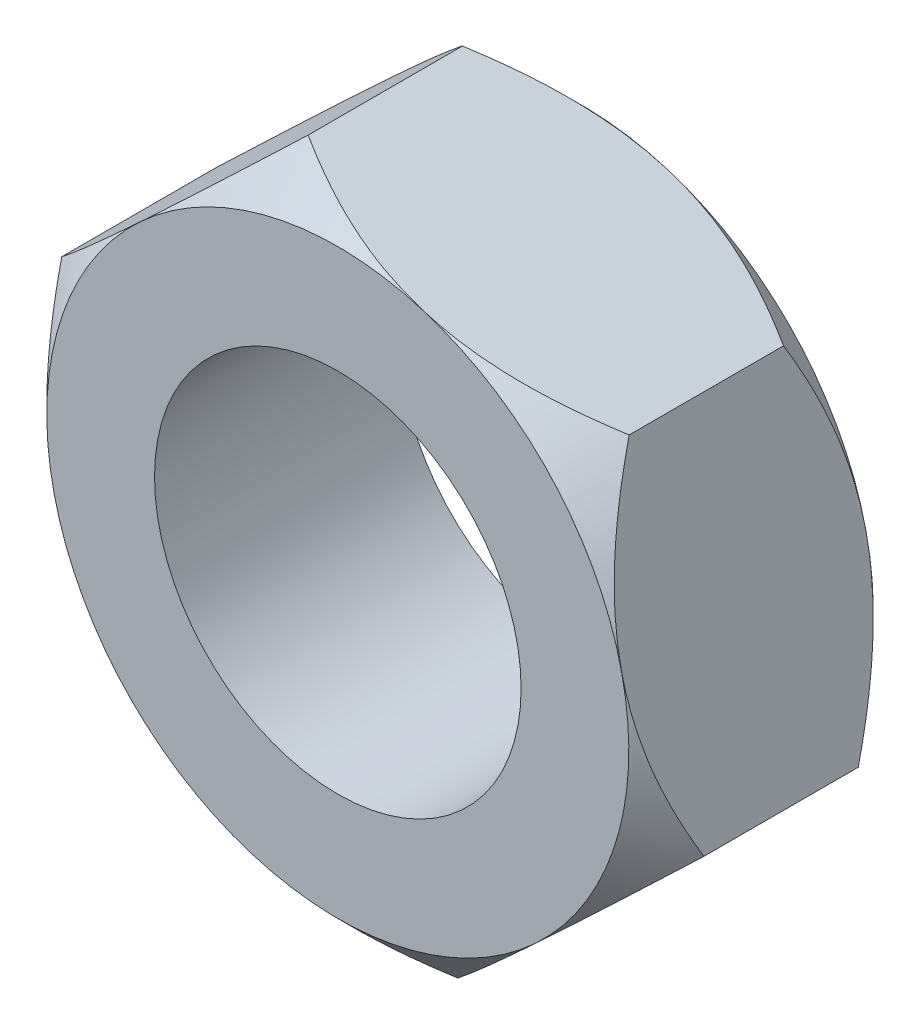
from build123d import *

# Parameters (mm, degrees)
BOSS_EXTRUDE1_DEPTH      = 1
BOSS_EXTRUDE1_DEPTH_BACK = 1
CUT_EXTRUDE1_REACH       = 6.254
SKETCH2_R                = 1.5
SKETCH19_OUTSIDE_W       = 10.31
SKETCH19_OUTSIDE_H       = 10.416
SKETCH19_OUTSIDE_R       = 2.38156986
CUT_EXTRUDE7_DEPTH       = 0.75
CUT_EXTRUDE7_DRAFT       = -45
MIRROR1_COPY_1_SKETCH_W  = 10.31
MIRROR1_COPY_1_SKETCH_H  = 10.416
MIRROR1_COPY_1_SKETCH_R  = 2.38156986
MIRROR1_COPY_1_DEPTH     = 0.75
MIRROR1_COPY_1_DRAFT     = -45


with BuildPart() as part:
    # Sketch1 → Boss-Extrude1 (new, two sides: drawn at the far end of the back side and taken through both)
    with BuildSketch(Plane.XY.offset(-BOSS_EXTRUDE1_DEPTH_BACK)):
        Polygon((2.627673365, -0.811068855), (2.016242915, 1.87009746), (-0.61143045, 2.681166314), (-2.627673365, 0.811068855), (-2.016242915, -1.87009746), (0.61143045, -2.681166314), align=None)
    extrude(amount=BOSS_EXTRUDE1_DEPTH + BOSS_EXTRUDE1_DEPTH_BACK)

    # Sketch2 → Cut-Extrude1 (cut, up to next)
    with BuildSketch(Plane.XY.offset(1), mode=Mode.PRIVATE) as cut_extrude1_sk1:
        Circle(SKETCH2_R)
    cut_extrude1_tool1 = extrude(cut_extrude1_sk1.sketch, amount=-CUT_EXTRUDE1_REACH, mode=Mode.PRIVATE) & part.part
    add(cut_extrude1_tool1.solids().sort_by_distance((0, 0, 1))[0], mode=Mode.SUBTRACT)


with BuildPart() as cut_extrude7_tool:
    # Sketch19 outside → Cut-Extrude7 (with draft: the straight prism first)
    with BuildSketch(Plane.XY.offset(1)):
        Rectangle(SKETCH19_OUTSIDE_W, SKETCH19_OUTSIDE_H)
        Circle(SKETCH19_OUTSIDE_R, mode=Mode.SUBTRACT)
    extrude(amount=-CUT_EXTRUDE7_DEPTH)
    # Cut-Extrude7: the draft: its side faces are tilted about the plane it starts from
    cut_extrude7_sides = [cut_extrude7_tool.faces().sort_by_distance(p)[0] for p in [
        (0, -5.208, 0.625),
        (5.155, 0, 0.625),
        (0, 5.208, 0.625),
        (-5.155, 0, 0.625),
        (-2.38156986, 0, 0.625),
    ]]
    draft(cut_extrude7_sides, Plane.XY.offset(1), CUT_EXTRUDE7_DRAFT)


with BuildPart() as part_1:
    add(part.part)

    # Cut-Extrude7: cut by cut_extrude7_tool
    add(cut_extrude7_tool.part, mode=Mode.SUBTRACT)


with BuildPart() as mirror1_copy_1_tool:
    # Mirror1 copy 1 sketch → Mirror1 copy 1 (with draft: the straight prism first)
    with BuildSketch(Plane(origin=(0, 0, -1), x_dir=(1, 0, 0), z_dir=(0, 0, -1))):
        Rectangle(MIRROR1_COPY_1_SKETCH_W, MIRROR1_COPY_1_SKETCH_H)
        Circle(MIRROR1_COPY_1_SKETCH_R, mode=Mode.SUBTRACT)
    extrude(amount=-MIRROR1_COPY_1_DEPTH)
    # Mirror1 copy 1: the draft: its side faces are tilted about the plane it starts from
    mirror1_copy_1_sides = [mirror1_copy_1_tool.faces().sort_by_distance(p)[0] for p in [
        (0, -5.208, -0.625),
        (5.155, 0, -0.625),
        (0, 5.208, -0.625),
        (-5.155, 0, -0.625),
        (-2.38156986, 0, -0.625),
    ]]
    draft(mirror1_copy_1_sides, Plane(origin=(0, 0, -1), x_dir=(1, 0, 0), z_dir=(0, 0, -1)), MIRROR1_COPY_1_DRAFT)


with BuildPart() as part_2:
    add(part_1.part)

    # Mirror1 copy 1: cut by mirror1_copy_1_tool
    add(mirror1_copy_1_tool.part, mode=Mode.SUBTRACT)


solid = part_2.part
